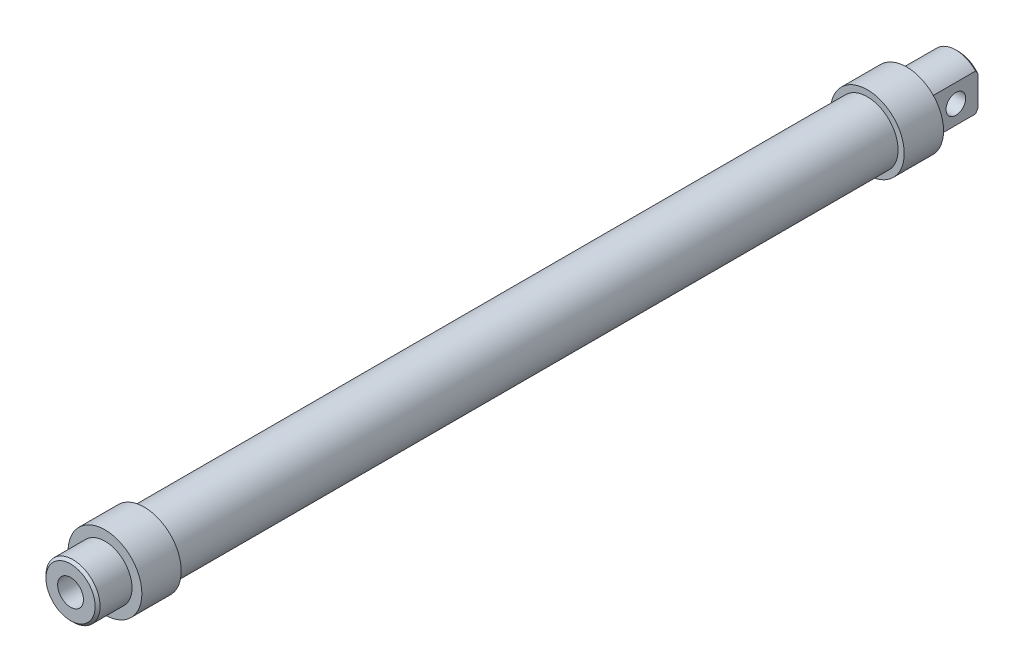
from build123d import *

# Parameters (mm, degrees)
ESQUISSE1_R             = 12.5
BOSS_EXTRU_1_DEPTH      = 326
ESQUISSE2_R             = 15
BOSS_EXTRU_2_DEPTH      = 16
BOSS_EXTRU_4_START      = -310
ESQUISSE2_2_R           = 15
BOSS_EXTRU_4_DEPTH      = 16
ESQUISSE3_R             = 11
BOSS_EXTRU_5_DEPTH      = 21
ESQUISSE4_W             = 5
ESQUISSE4_H             = 22
ENL_V_MAT_EXTRU_1_DEPTH = 19
ESQUISSE5_R             = 4
ENL_V_MAT_EXTRU_2_DEPTH = 328.1543978
BOSS_EXTRU_6_START      = 14
ESQUISSE6_R             = 11
BOSS_EXTRU_6_DEPTH      = 14
CHANFREIN1_SIZE         = 1
ESQUISSE7_R             = 5.25
ENL_V_MAT_EXTRU_3_DEPTH = 250


with BuildPart() as part:
    # Esquisse1 → Boss.-Extru.1 (new body)
    with BuildSketch(Plane.XY):
        Circle(ESQUISSE1_R)
    extrude(amount=BOSS_EXTRU_1_DEPTH)

    # Esquisse2 → Boss.-Extru.2 (add)
    with BuildSketch(Plane.XY.offset(326)):
        Circle(ESQUISSE2_R)
    extrude(amount=-BOSS_EXTRU_2_DEPTH)

    # Esquisse2<2> → Boss.-Extru.4 (add)
    with BuildSketch(Plane.XY.offset(326).offset(BOSS_EXTRU_4_START)):
        Circle(ESQUISSE2_2_R)
    extrude(amount=-BOSS_EXTRU_4_DEPTH)

    # Esquisse3 → Boss.-Extru.5 (add)
    with BuildSketch(Plane(origin=(0, 0, 0), x_dir=(-1, 0, 0), z_dir=(0, 0, -1))):
        Circle(ESQUISSE3_R)
    extrude(amount=BOSS_EXTRU_5_DEPTH)

    # Esquisse4 → Enlèv. mat.-Extru.1 (cut)
    with BuildSketch(Plane(origin=(0, 0, -21), x_dir=(-1, 0, 0), z_dir=(0, 0, -1))):
        with Locations((-10.5, 0)):
            Rectangle(ESQUISSE4_W, ESQUISSE4_H)
        with Locations((10.5, 0)):
            Rectangle(ESQUISSE4_W, ESQUISSE4_H)
    extrude(amount=-ENL_V_MAT_EXTRU_1_DEPTH, mode=Mode.SUBTRACT)

    # Esquisse5 → Enlèv. mat.-Extru.2 (cut, through all)
    with BuildSketch(Plane(origin=(8, 0, 0), x_dir=(0, 0, -1), z_dir=(1, 0, 0))):
        with Locations((12, 0)):
            Circle(ESQUISSE5_R)
    extrude(amount=-ENL_V_MAT_EXTRU_2_DEPTH, mode=Mode.SUBTRACT)

    # Esquisse6 → Boss.-Extru.6 (add)
    with BuildSketch(Plane.XY.offset(326).offset(BOSS_EXTRU_6_START)):
        Circle(ESQUISSE6_R)
    extrude(amount=-BOSS_EXTRU_6_DEPTH)

    # Chanfrein1
    chanfrein1_edges = [part.edges().sort_by_distance(p)[0] for p in [
        (-8, 0, -2),
        (8, 0, -2),
        (0, -11, -21),
        (0, 11, -21),
        (-11, 0, 340),
    ]]
    chamfer(chanfrein1_edges, length=CHANFREIN1_SIZE)

    # Esquisse7 → Enlèv. mat.-Extru.3 (cut)
    with BuildSketch(Plane.XY.offset(340)):
        Circle(ESQUISSE7_R)
    extrude(amount=-ENL_V_MAT_EXTRU_3_DEPTH, mode=Mode.SUBTRACT)


solid = part.part
